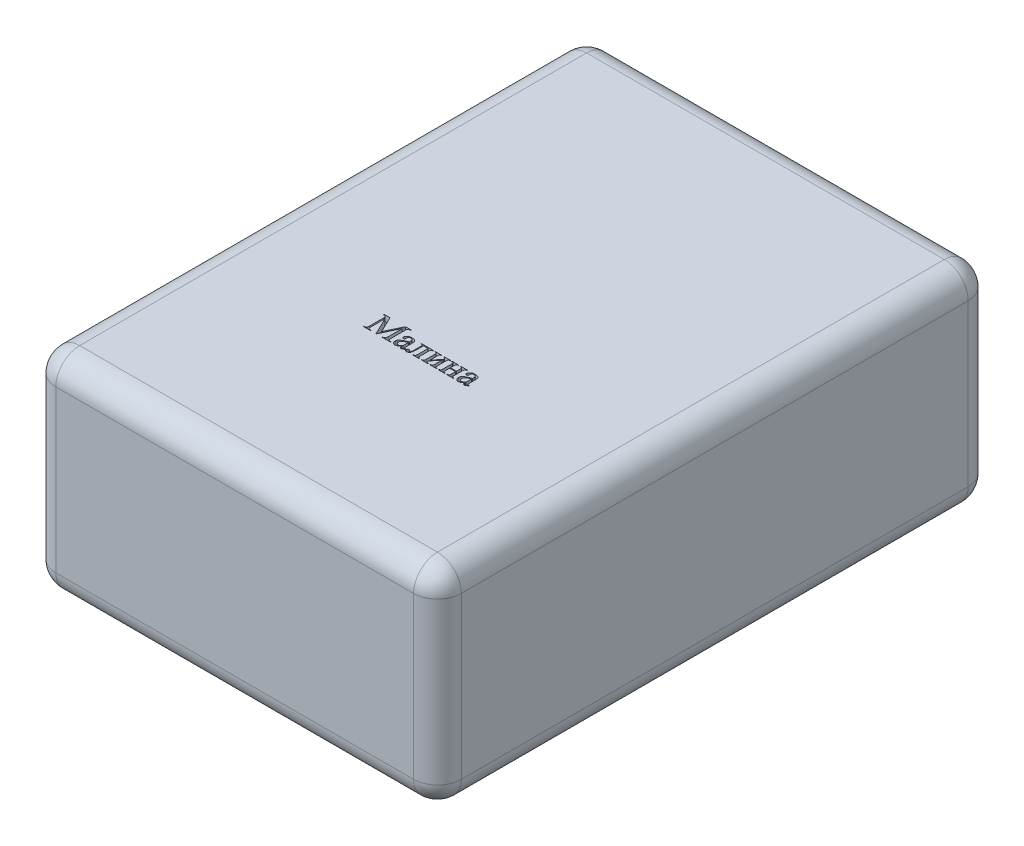
from build123d import *

# Parameters (mm, degrees)
SKETCH_1_W          = 68
SKETCH_1_H          = 93
EXTRUDE_1_DEPTH     = 35
SKETCH_2_R          = 1.5
CUT_EXTRUDE_1_DEPTH = 5
CUT_EXTRUDE_2_DEPTH = 1
FILLET_1_R          = 4


with BuildPart() as part:
    # Эскиз1 → Бобышка-Вытянуть1 (new body)
    with BuildSketch(Plane(origin=(0, 0, 0), x_dir=(1, 0, 0), z_dir=(0, 1, 0))):
        Rectangle(SKETCH_1_W, SKETCH_1_H)
    extrude(amount=EXTRUDE_1_DEPTH)

    # Эскиз2 → Вырез-Вытянуть1 (cut)
    with BuildSketch(Plane.XZ):
        with Locations(Location((20, 0, 0), (0, 0, 270))):
            Circle(SKETCH_2_R)
        with Locations(Location((-20, 0, 0), (0, 0, 270))):
            Circle(SKETCH_2_R)
    extrude(amount=-CUT_EXTRUDE_1_DEPTH, mode=Mode.SUBTRACT)

    # Эскиз3 → Вырез-Вытянуть2 (cut)
    # profile 1 of 6: a face of its own
    with BuildSketch(Plane(origin=(0, 35, 0), x_dir=(1, 0, 0), z_dir=(0, 1, 0))):
        with BuildLine():
            Line((-6.876278242, -15.938909671), (-8.286000464, -12.994139706))
            Line((-8.286000464, -12.994139706), (-8.286000464, -15.306965227))
            add(Edge.make_bspline(
                [(-8.286000464, -15.306965227), (-8.286036387, -15.333811298), (-8.286104549, -15.384749757), (-8.281755016, -15.457154027), (-8.277037345, -15.521848158), (-8.269202477, -15.578542427), (-8.260888196, -15.627848302), (-8.248500347, -15.668563983), (-8.235625296, -15.702397991), (-8.223275685, -15.72033213), (-8.217641089, -15.728514706)],
                knots=[0, 0, 0, 0, 1.48973486, 2.826663046, 4.025252461, 5.088590954, 6.003687083, 6.795186099, 7.45029523, 8, 8, 8, 8], degree=3))
            add(Edge.make_bspline(
                [(-8.217641089, -15.728514706), (-8.200462589, -15.74599363), (-8.165480149, -15.781587856), (-8.095240268, -15.817376133), (-8.012557284, -15.838563876), (-7.952957678, -15.840606485), (-7.921417131, -15.841687449)],
                knots=[0, 0, 0, 0, 0.893460505, 1.819450328, 2.846037184, 4, 4, 4, 4], degree=3))
            Line((-7.921417131, -15.841687449), (-7.799889353, -15.841687449))
            Line((-7.799889353, -15.841687449), (-7.799889353, -15.938909671))
            Line((-7.799889353, -15.938909671), (-9.015167131, -15.938909671))
            Line((-9.015167131, -15.938909671), (-9.015167131, -15.841687449))
            Line((-9.015167131, -15.841687449), (-8.893639353, -15.841687449))
            add(Edge.make_bspline(
                [(-8.893639353, -15.841687449), (-8.876140053, -15.841305447), (-8.842265284, -15.840565977), (-8.793511394, -15.833321815), (-8.748469314, -15.823266262), (-8.707484134, -15.807619561), (-8.67016689, -15.788182546), (-8.637031928, -15.763633985), (-8.60866068, -15.734176649), (-8.592613743, -15.712252285), (-8.584503068, -15.701170956)],
                knots=[0, 0, 0, 0, 1.182386838, 2.288838982, 3.326958154, 4.296765023, 5.246416275, 6.164047556, 7.072046332, 8, 8, 8, 8], degree=3))
            add(Edge.make_bspline(
                [(-8.584503068, -15.701170956), (-8.579975705, -15.692920025), (-8.570009103, -15.67475631), (-8.558979447, -15.642463413), (-8.550378289, -15.603133861), (-8.541854542, -15.557355686), (-8.535884286, -15.504317994), (-8.532777005, -15.444715815), (-8.529112251, -15.378150572), (-8.529075425, -15.331530474), (-8.52905602, -15.306965227)],
                knots=[0, 0, 0, 0, 0.561580455, 1.236271222, 2.028879402, 2.966584022, 4.017422664, 5.2149421, 6.532486222, 8, 8, 8, 8], degree=3))
            Line((-8.52905602, -15.306965227), (-8.52905602, -13.070854115))
            add(Edge.make_bspline(
                [(-8.52905602, -13.070854115), (-8.529438437, -13.033090794), (-8.530148393, -12.962983405), (-8.540146678, -12.866554344), (-8.554313006, -12.786205245), (-8.571984921, -12.740522051), (-8.579945777, -12.719942657)],
                knots=[0, 0, 0, 0, 1.269100049, 2.356076937, 3.259444487, 4, 4, 4, 4], degree=3))
            add(Edge.make_bspline(
                [(-8.579945777, -12.719942657), (-8.586616445, -12.707274014), (-8.600339558, -12.681211675), (-8.629494734, -12.64640325), (-8.666626678, -12.6155346), (-8.711210957, -12.586779556), (-8.767584425, -12.562621261), (-8.837719825, -12.54695684), (-8.921723829, -12.537331635), (-8.982474471, -12.536551642), (-9.015167131, -12.536131893)],
                knots=[0, 0, 0, 0, 0.685675889, 1.410594349, 2.160436148, 2.996293973, 3.94870651, 5.086176952, 6.431940446, 8, 8, 8, 8], degree=3))
            Line((-9.015167131, -12.536131893), (-9.015167131, -12.438909671))
            Line((-9.015167131, -12.438909671), (-8.018639353, -12.438909671))
            Line((-8.018639353, -12.438909671), (-6.716773034, -15.158093699))
            Line((-6.716773034, -15.158093699), (-5.414906714, -12.438909671))
            Line((-5.414906714, -12.438909671), (-4.445722686, -12.438909671))
            Line((-4.445722686, -12.438909671), (-4.445722686, -12.536131893))
            Line((-4.445722686, -12.536131893), (-4.564971818, -12.536131893))
            add(Edge.make_bspline(
                [(-4.564971818, -12.536131893), (-4.582726783, -12.53649584), (-4.616859546, -12.537195503), (-4.666085587, -12.544607664), (-4.711444006, -12.55441438), (-4.752632286, -12.570222761), (-4.790004254, -12.589593963), (-4.823097085, -12.614435718), (-4.852251313, -12.643372684), (-4.868318621, -12.665524799), (-4.876386749, -12.676648386)],
                knots=[0, 0, 0, 0, 1.192663738, 2.292818382, 3.341598875, 4.305885976, 5.250132179, 6.162540657, 7.077327887, 8, 8, 8, 8], degree=3))
            add(Edge.make_bspline(
                [(-4.876386749, -12.676648386), (-4.880914112, -12.684899317), (-4.890880714, -12.703063032), (-4.90191037, -12.735355929), (-4.910511528, -12.774685482), (-4.919035275, -12.820463656), (-4.925005531, -12.873501348), (-4.928112812, -12.933103527), (-4.931777566, -12.99966877), (-4.931814392, -13.046288868), (-4.931833797, -13.070854115)],
                knots=[0, 0, 0, 0, 0.561580455, 1.236271222, 2.028879402, 2.966584022, 4.017422664, 5.2149421, 6.532486222, 8, 8, 8, 8], degree=3))
            Line((-4.931833797, -13.070854115), (-4.931833797, -15.306965227))
            add(Edge.make_bspline(
                [(-4.931833797, -15.306965227), (-4.931866137, -15.333810551), (-4.931927498, -15.384747593), (-4.927623405, -15.457161334), (-4.922759422, -15.521824968), (-4.915373164, -15.578662197), (-4.905673358, -15.627729179), (-4.893816332, -15.668752675), (-4.879921955, -15.702473471), (-4.867074696, -15.720339288), (-4.861195777, -15.728514706)],
                knots=[0, 0, 0, 0, 1.486776415, 2.821049613, 4.017258766, 5.078485589, 5.994452933, 6.784380121, 7.443731031, 8, 8, 8, 8], degree=3))
            add(Edge.make_bspline(
                [(-4.861195777, -15.728514706), (-4.844032017, -15.74602478), (-4.80892212, -15.781843093), (-4.738390432, -15.817022432), (-4.655910826, -15.838704874), (-4.596527706, -15.840652494), (-4.564971818, -15.841687449)],
                knots=[0, 0, 0, 0, 0.893634595, 1.828003868, 2.845812335, 4, 4, 4, 4], degree=3))
            Line((-4.564971818, -15.841687449), (-4.445722686, -15.841687449))
            Line((-4.445722686, -15.841687449), (-4.445722686, -15.938909671))
            Line((-4.445722686, -15.938909671), (-5.90405602, -15.938909671))
            Line((-5.90405602, -15.938909671), (-5.90405602, -15.841687449))
            Line((-5.90405602, -15.841687449), (-5.782528242, -15.841687449))
            add(Edge.make_bspline(
                [(-5.782528242, -15.841687449), (-5.764776666, -15.841312345), (-5.730650417, -15.840591233), (-5.681623435, -15.833364114), (-5.636425797, -15.823069561), (-5.595178686, -15.808014804), (-5.558168466, -15.787933648), (-5.525180506, -15.763639231), (-5.496768943, -15.734378557), (-5.481211647, -15.712279024), (-5.473391957, -15.701170956)],
                knots=[0, 0, 0, 0, 1.198333024, 2.303717216, 3.340834392, 4.325725627, 5.259386468, 6.176132048, 7.08325442, 8, 8, 8, 8], degree=3))
            add(Edge.make_bspline(
                [(-5.473391957, -15.701170956), (-5.468864594, -15.692920025), (-5.458897991, -15.67475631), (-5.447868336, -15.642463413), (-5.439267178, -15.603133861), (-5.430743431, -15.557355686), (-5.424773175, -15.504317994), (-5.421665894, -15.444715815), (-5.41800114, -15.378150572), (-5.417964314, -15.331530474), (-5.417944909, -15.306965227)],
                knots=[0, 0, 0, 0, 0.561580455, 1.236271222, 2.028879402, 2.966584022, 4.017422664, 5.2149421, 6.532486222, 8, 8, 8, 8], degree=3))
            Line((-5.417944909, -15.306965227), (-5.417944909, -12.994139706))
            Line((-5.417944909, -12.994139706), (-6.827667131, -15.938909671))
            Line((-6.827667131, -15.938909671), (-6.876278242, -15.938909671))
        make_face()
    # profile 2 of 6: a face of its own
    with BuildSketch(Plane(origin=(0, 35, 0), x_dir=(1, 0, 0), z_dir=(0, 1, 0))):
        with BuildLine():
            add(Edge.make_bspline(
                [(-2.890167131, -15.600910539), (-2.918960068, -15.623030395), (-2.973573413, -15.664986496), (-3.052065141, -15.723042978), (-3.120997942, -15.775384656), (-3.182380519, -15.818945906), (-3.23507933, -15.855998916), (-3.279501721, -15.885195042), (-3.315064339, -15.907990036), (-3.33671114, -15.919032968), (-3.345896297, -15.923718699)],
                knots=[0, 0, 0, 0, 1.558875, 2.95681467, 4.191698034, 5.274657479, 6.188356203, 6.95716577, 7.557505181, 8, 8, 8, 8], degree=3))
            add(Edge.make_bspline(
                [(-3.345896297, -15.923718699), (-3.369230894, -15.933691571), (-3.41575288, -15.953574401), (-3.489200108, -15.97254508), (-3.564424312, -15.985689793), (-3.61547657, -15.986904772), (-3.641360707, -15.987520782)],
                knots=[0, 0, 0, 0, 0.998482016, 1.990665029, 2.981241918, 4, 4, 4, 4], degree=3))
            add(Edge.make_bspline(
                [(-3.641360707, -15.987520782), (-3.661381765, -15.986825375), (-3.700553833, -15.985464782), (-3.75817724, -15.978059967), (-3.812902241, -15.964316029), (-3.864661679, -15.945102969), (-3.914149751, -15.921569906), (-3.960447789, -15.891506928), (-4.004672683, -15.856637101), (-4.045538805, -15.816299558), (-4.082632492, -15.771895503), (-4.114506393, -15.723532487), (-4.142622882, -15.67229414), (-4.163839569, -15.616858263), (-4.182004199, -15.558651736), (-4.193544343, -15.496952901), (-4.201692464, -15.432002541), (-4.202336784, -15.387505093), (-4.202667131, -15.364690921)],
                knots=[0, 0, 0, 0, 1.021269733, 1.99815853, 2.956354521, 3.891750869, 4.809880197, 5.744652621, 6.700410006, 7.677298803, 8.667491899, 9.645063, 10.627057522, 11.641202316, 12.666381854, 13.732374063, 14.837371315, 16, 16, 16, 16], degree=3))
            add(Edge.make_bspline(
                [(-4.202667131, -15.364690921), (-4.202033224, -15.335984472), (-4.200800542, -15.280162513), (-4.184308544, -15.200113344), (-4.162133122, -15.124829772), (-4.13742052, -15.080009527), (-4.125193172, -15.057833282)],
                knots=[0, 0, 0, 0, 1.073591545, 2.087683635, 3.053820535, 4, 4, 4, 4], degree=3))
            add(Edge.make_bspline(
                [(-4.125193172, -15.057833282), (-4.105312109, -15.02777403), (-4.063555069, -14.96463931), (-3.979375108, -14.879513242), (-3.877367805, -14.796335018), (-3.777618271, -14.730826225), (-3.685722968, -14.677126769), (-3.603606674, -14.635314715), (-3.51115249, -14.590316295), (-3.408486191, -14.54229105), (-3.293733568, -14.494155659), (-3.168958758, -14.442650575), (-3.03350905, -14.388271035), (-2.939110545, -14.353019895), (-2.890167131, -14.334743004)],
                knots=[0, 0, 0, 0, 0.890335071, 1.870008429, 2.947759746, 4.145438777, 4.819447813, 5.581919563, 6.425634938, 7.365025325, 8.387143385, 9.505655779, 10.706740942, 12, 12, 12, 12], degree=3))
            Line((-2.890167131, -14.334743004), (-2.890167131, -14.245875817))
            add(Edge.make_bspline(
                [(-2.890167131, -14.245875817), (-2.89039643, -14.218779255), (-2.890838378, -14.166553839), (-2.895921798, -14.09143546), (-2.90550665, -14.023127808), (-2.915879369, -13.961070436), (-2.93219926, -13.906336605), (-2.950941386, -13.857739725), (-2.973603889, -13.815806915), (-3.008062016, -13.769003317), (-3.060934676, -13.72189797), (-3.13693247, -13.681517919), (-3.225750903, -13.657725153), (-3.289031126, -13.655407678), (-3.32235029, -13.654187449)],
                knots=[0, 0, 0, 0, 1.156239016, 2.228513829, 3.209486664, 4.099496727, 4.909803097, 5.642093741, 6.318967722, 6.93697649, 8.115067704, 9.304155298, 10.580547167, 12, 12, 12, 12], degree=3))
            add(Edge.make_bspline(
                [(-3.32235029, -13.654187449), (-3.347794101, -13.655001594), (-3.396507547, -13.656560317), (-3.465251644, -13.674126233), (-3.526851878, -13.700560074), (-3.560360774, -13.728049957), (-3.576799075, -13.741535539)],
                knots=[0, 0, 0, 0, 1.106638015, 2.118713769, 3.077106298, 4, 4, 4, 4], degree=3))
            add(Edge.make_bspline(
                [(-3.576799075, -13.741535539), (-3.591696079, -13.755878072), (-3.620162292, -13.783284765), (-3.650308297, -13.832951489), (-3.669871717, -13.885426979), (-3.672130009, -13.922139066), (-3.673261749, -13.940537275)],
                knots=[0, 0, 0, 0, 1.084622452, 2.072570699, 3.034071598, 4, 4, 4, 4], degree=3))
            Line((-3.673261749, -13.940537275), (-3.667944909, -14.089408803))
            add(Edge.make_bspline(
                [(-3.667944909, -14.089408803), (-3.668570193, -14.10796472), (-3.669757213, -14.143190629), (-3.681452266, -14.192822322), (-3.70000239, -14.236210075), (-3.727499156, -14.271713973), (-3.760150891, -14.300266979), (-3.79869358, -14.320373252), (-3.841855434, -14.332973246), (-3.872426072, -14.334140293), (-3.888214006, -14.334743004)],
                knots=[0, 0, 0, 0, 1.192988088, 2.264727143, 3.264608775, 4.207008523, 5.131898225, 6.036298471, 6.985863792, 8, 8, 8, 8], degree=3))
            add(Edge.make_bspline(
                [(-3.888214006, -14.334743004), (-3.903535631, -14.334247787), (-3.933263966, -14.333286924), (-3.974932117, -14.31903231), (-4.013512706, -14.29964841), (-4.04590167, -14.270084623), (-4.073207883, -14.234062616), (-4.091828351, -14.190778912), (-4.103594335, -14.141933006), (-4.104808945, -14.107459134), (-4.105444909, -14.089408803)],
                knots=[0, 0, 0, 0, 0.992015986, 1.924794819, 2.838757396, 3.784255213, 4.749783075, 5.760236574, 6.827272098, 8, 8, 8, 8], degree=3))
            add(Edge.make_bspline(
                [(-4.105444909, -14.089408803), (-4.104682316, -14.071375978), (-4.103165381, -14.035505381), (-4.091875338, -13.982464608), (-4.074655595, -13.93041398), (-4.048869245, -13.879989385), (-4.016701836, -13.830457297), (-3.977883678, -13.781521256), (-3.931114646, -13.734691372), (-3.878118426, -13.689033897), (-3.818530177, -13.646799426), (-3.75302308, -13.609373997), (-3.681416461, -13.57808092), (-3.604359165, -13.552519134), (-3.521225715, -13.532768754), (-3.432649527, -13.51844028), (-3.338203197, -13.510201812), (-3.273501917, -13.508980488), (-3.24031904, -13.508354115)],
                knots=[0, 0, 0, 0, 0.751350949, 1.494574915, 2.252349993, 3.031299287, 3.848234099, 4.712108084, 5.630260355, 6.603499815, 7.625714709, 8.670571574, 9.743474444, 10.878456939, 12.051105368, 13.302367809, 14.616484898, 16, 16, 16, 16], degree=3))
            add(Edge.make_bspline(
                [(-3.24031904, -13.508354115), (-3.19011076, -13.509606125), (-3.093832453, -13.512006951), (-2.956756273, -13.531725696), (-2.832930922, -13.563825106), (-2.759353966, -13.598639636), (-2.723825985, -13.61545047)],
                knots=[0, 0, 0, 0, 1.131049808, 2.168876517, 3.115808485, 4, 4, 4, 4], degree=3))
            add(Edge.make_bspline(
                [(-2.723825985, -13.61545047), (-2.699407253, -13.630036748), (-2.650784644, -13.659080965), (-2.588489292, -13.7183486), (-2.536884146, -13.789121368), (-2.511812711, -13.84257898), (-2.498999596, -13.869899254)],
                knots=[0, 0, 0, 0, 0.983173165, 1.957695623, 2.956251224, 4, 4, 4, 4], degree=3))
            add(Edge.make_bspline(
                [(-2.498999596, -13.869899254), (-2.495320445, -13.880488799), (-2.487267488, -13.903667281), (-2.477183629, -13.942912889), (-2.470566055, -13.989830063), (-2.463118208, -14.043661452), (-2.459306824, -14.105085491), (-2.455229571, -14.173672552), (-2.45307543, -14.249913981), (-2.452807466, -14.303094315), (-2.452667131, -14.330945261)],
                knots=[0, 0, 0, 0, 0.578071798, 1.265288381, 2.085304142, 3.019791722, 4.067310373, 5.257317904, 6.563636446, 8, 8, 8, 8], degree=3))
            Line((-2.452667131, -14.330945261), (-2.452667131, -15.145940921))
            add(Edge.make_bspline(
                [(-2.452667131, -15.145940921), (-2.452755509, -15.173285288), (-2.452922451, -15.224937076), (-2.451814913, -15.298355173), (-2.451498733, -15.363184205), (-2.449593699, -15.419882375), (-2.4485475, -15.468273498), (-2.445957946, -15.508506028), (-2.444122628, -15.540473786), (-2.440318331, -15.570762805), (-2.433708621, -15.599972114), (-2.425148672, -15.629331711), (-2.413767238, -15.652421578), (-2.397227954, -15.674922021), (-2.369203282, -15.691343764), (-2.345249776, -15.694362847), (-2.333417999, -15.695854115)],
                knots=[0, 0, 0, 0, 1.895498962, 3.580478337, 5.089959178, 6.389201248, 7.513008224, 8.444695769, 9.183712318, 9.732301295, 10.558500312, 11.257899372, 11.846575001, 12.334540979, 13.177350527, 14, 14, 14, 14], degree=3))
            add(Edge.make_bspline(
                [(-2.333417999, -15.695854115), (-2.320821989, -15.695101953), (-2.296758158, -15.693664996), (-2.274775226, -15.683830675), (-2.264299075, -15.679144046)],
                knots=[0, 0, 0, 0, 1.04688317, 2, 2, 2, 2], degree=3))
            add(Edge.make_bspline(
                [(-2.264299075, -15.679144046), (-2.253513516, -15.671742733), (-2.22672602, -15.653360503), (-2.184077783, -15.614272211), (-2.126927343, -15.563685289), (-2.086351835, -15.523671024), (-2.063778242, -15.501409671)],
                knots=[0, 0, 0, 0, 0.584543641, 1.451798638, 2.582345273, 4, 4, 4, 4], degree=3))
            Line((-2.063778242, -15.501409671), (-2.063778242, -15.637368872))
            add(Edge.make_bspline(
                [(-2.063778242, -15.637368872), (-2.087228508, -15.665022805), (-2.132336043, -15.718216262), (-2.202883066, -15.789872074), (-2.273047459, -15.85027514), (-2.34202645, -15.900335704), (-2.410756998, -15.938592926), (-2.478397096, -15.966607145), (-2.545675967, -15.984473125), (-2.590802885, -15.986518021), (-2.612931888, -15.987520782)],
                knots=[0, 0, 0, 0, 1.29495671, 2.490901519, 3.587659578, 4.59909354, 5.530268421, 6.390197302, 7.210596943, 8, 8, 8, 8], degree=3))
            add(Edge.make_bspline(
                [(-2.612931888, -15.987520782), (-2.633073299, -15.986682917), (-2.671849183, -15.985069873), (-2.726545382, -15.967431155), (-2.77467439, -15.939699718), (-2.81664919, -15.900319911), (-2.850103438, -15.846441629), (-2.87222249, -15.777457014), (-2.887783997, -15.694255048), (-2.889331, -15.633660781), (-2.890167131, -15.600910539)],
                knots=[0, 0, 0, 0, 0.892412594, 1.718056717, 2.524775051, 3.344648327, 4.249949684, 5.310413251, 6.546320934, 8, 8, 8, 8], degree=3))
        make_face()
        with BuildLine():
            Line((-2.890167131, -15.42545481), (-2.890167131, -14.480576338))
            add(Edge.make_bspline(
                [(-2.890167131, -14.480576338), (-2.921044854, -14.493766029), (-2.979773634, -14.518852544), (-3.063890753, -14.554338601), (-3.138893711, -14.587954777), (-3.205622981, -14.618034607), (-3.263548533, -14.645513587), (-3.312944557, -14.669777728), (-3.35409068, -14.690837411), (-3.37834127, -14.704574036), (-3.389190568, -14.710719567)],
                knots=[0, 0, 0, 0, 1.465697383, 2.787725602, 3.985057731, 5.053380534, 5.982790254, 6.783498627, 7.455758124, 8, 8, 8, 8], degree=3))
            add(Edge.make_bspline(
                [(-3.389190568, -14.710719567), (-3.421015437, -14.730085993), (-3.48137389, -14.766815995), (-3.560971101, -14.829078833), (-3.627295945, -14.891757235), (-3.678977712, -14.957134517), (-3.718364796, -15.024571457), (-3.744362429, -15.095157629), (-3.762547385, -15.168321172), (-3.764285881, -15.218491273), (-3.765167131, -15.243922692)],
                knots=[0, 0, 0, 0, 1.302370349, 2.470051283, 3.52876103, 4.487475757, 5.376328791, 6.248248042, 7.112030167, 8, 8, 8, 8], degree=3))
            add(Edge.make_bspline(
                [(-3.765167131, -15.243922692), (-3.763978595, -15.275189482), (-3.761689147, -15.335417966), (-3.74047126, -15.421962245), (-3.705483816, -15.500014596), (-3.65758574, -15.568148592), (-3.601356293, -15.624263879), (-3.539111477, -15.665798684), (-3.471746713, -15.690738699), (-3.42533827, -15.694147451), (-3.402102895, -15.695854115)],
                knots=[0, 0, 0, 0, 1.168223595, 2.250321665, 3.310218344, 4.350849945, 5.348877238, 6.265796639, 7.13173418, 8, 8, 8, 8], degree=3))
            add(Edge.make_bspline(
                [(-3.402102895, -15.695854115), (-3.385081489, -15.694792391), (-3.349643836, -15.692581938), (-3.294672628, -15.679651405), (-3.23635516, -15.657888704), (-3.174064275, -15.628168638), (-3.108504308, -15.589363174), (-3.0384727, -15.543137923), (-2.965237269, -15.487395721), (-2.915848157, -15.446644409), (-2.890167131, -15.42545481)],
                knots=[0, 0, 0, 0, 0.693887409, 1.444636304, 2.289794561, 3.226439617, 4.252586567, 5.391242417, 6.643515343, 8, 8, 8, 8], degree=3))
        make_face(mode=Mode.SUBTRACT)
    # profile 3 of 6: a face of its own
    with BuildSketch(Plane(origin=(0, 35, 0), x_dir=(1, 0, 0), z_dir=(0, 1, 0))):
        with BuildLine():
            Line((-1.626278242, -13.556965227), (0.415388425, -13.556965227))
            Line((0.415388425, -13.556965227), (0.415388425, -13.654187449))
            add(Edge.make_bspline(
                [(0.415388425, -13.654187449), (0.390058985, -13.654621939), (0.343870177, -13.655414243), (0.281245874, -13.660898219), (0.232039298, -13.670744532), (0.185483291, -13.689169761), (0.144588075, -13.723462308), (0.11285693, -13.757624434), (0.097948313, -13.787934639), (0.092933875, -13.811343329), (0.086053656, -13.840721848), (0.083471861, -13.877770656), (0.078991976, -13.921206891), (0.077258907, -13.971926648), (0.07562102, -14.029392677), (0.07528698, -14.070164674), (0.075110647, -14.091687449)],
                knots=[0, 0, 0, 0, 1.584210393, 2.888843606, 3.926246297, 4.714344826, 5.990707065, 7.227458523, 7.595770758, 8.087420743, 8.717843885, 9.482035482, 10.403870704, 11.450058471, 12.653933574, 14, 14, 14, 14], degree=3))
            Line((0.075110647, -14.091687449), (0.075110647, -15.404187449))
            add(Edge.make_bspline(
                [(0.075110647, -15.404187449), (0.075402363, -15.424694163), (0.075956988, -15.463682562), (0.076150645, -15.518907218), (0.078663545, -15.567774791), (0.081536849, -15.610079381), (0.085169205, -15.645833628), (0.089718167, -15.674991176), (0.094520213, -15.697759127), (0.106199213, -15.728854044), (0.137019477, -15.765146755), (0.177612495, -15.801365257), (0.225178956, -15.823661499), (0.27656214, -15.832939995), (0.341193734, -15.841181285), (0.389013317, -15.841507515), (0.415388425, -15.841687449)],
                knots=[0, 0, 0, 0, 1.282707916, 2.438748994, 3.453282145, 4.342284203, 5.090714305, 5.699887127, 6.187688219, 6.543528699, 7.765983447, 9.10408532, 9.925812853, 11.013000354, 12.352506862, 14, 14, 14, 14], degree=3))
            Line((0.415388425, -15.841687449), (0.415388425, -15.938909671))
            Line((0.415388425, -15.938909671), (-0.702667131, -15.938909671))
            Line((-0.702667131, -15.938909671), (-0.702667131, -15.841687449))
            add(Edge.make_bspline(
                [(-0.702667131, -15.841687449), (-0.678862587, -15.84139477), (-0.635269274, -15.840858786), (-0.57592193, -15.837197732), (-0.528585276, -15.83173475), (-0.490930719, -15.823037458), (-0.460868652, -15.807522401), (-0.435023789, -15.785751512), (-0.413947183, -15.755507312), (-0.398170809, -15.725593115), (-0.387118068, -15.695824538), (-0.380568765, -15.66671706), (-0.375884335, -15.631825174), (-0.370032098, -15.591424001), (-0.366558698, -15.545258756), (-0.364480784, -15.493323846), (-0.36292865, -15.435590385), (-0.362574997, -15.395073885), (-0.362389353, -15.373805504)],
                knots=[0, 0, 0, 0, 1.619790397, 2.966325718, 4.043311488, 4.862317155, 5.578882398, 6.324474976, 7.137661701, 8.070040465, 8.620525552, 9.293297089, 10.094904341, 11.015913183, 12.070340319, 13.242977978, 14.552752706, 16, 16, 16, 16], degree=3))
            Line((-0.362389353, -15.373805504), (-0.362389353, -13.70279856))
            Line((-0.362389353, -13.70279856), (-1.140167131, -13.70279856))
            Line((-1.140167131, -13.70279856), (-1.140167131, -14.71983415))
            add(Edge.make_bspline(
                [(-1.140167131, -14.71983415), (-1.140303084, -14.766167497), (-1.140564608, -14.855295665), (-1.14281157, -14.983420632), (-1.14659192, -15.10090953), (-1.151629145, -15.207538627), (-1.158786411, -15.303467541), (-1.165692412, -15.388683979), (-1.175631565, -15.463163969), (-1.190198174, -15.546299905), (-1.213596942, -15.637164674), (-1.255866532, -15.732277627), (-1.309111582, -15.812965817), (-1.374521401, -15.87749141), (-1.448377759, -15.926253735), (-1.527630157, -15.961663124), (-1.612407454, -15.983996246), (-1.670954043, -15.986332987), (-1.700714006, -15.987520782)],
                knots=[0, 0, 0, 0, 1.42271662, 2.736778907, 3.934650691, 5.032175841, 6.014232294, 6.888416739, 7.656971435, 8.320342229, 9.480171711, 10.527654744, 11.502266939, 12.431319192, 13.328298626, 14.205278702, 15.087720741, 16, 16, 16, 16], degree=3))
            add(Edge.make_bspline(
                [(-1.700714006, -15.987520782), (-1.725359275, -15.986843301), (-1.771844248, -15.985565461), (-1.836661662, -15.970968837), (-1.892048838, -15.947615239), (-1.937765563, -15.913941118), (-1.973634365, -15.870512855), (-1.997805347, -15.816734153), (-2.013395921, -15.754457776), (-2.01455537, -15.709631645), (-2.015167131, -15.685979984)],
                knots=[0, 0, 0, 0, 1.182968001, 2.231269376, 3.174287439, 4.053139709, 4.93527333, 5.850059015, 6.865624267, 8, 8, 8, 8], degree=3))
            add(Edge.make_bspline(
                [(-2.015167131, -15.685979984), (-2.014663566, -15.669729758), (-2.013685568, -15.638169389), (-2.003890388, -15.59306569), (-1.986772671, -15.552868243), (-1.964123891, -15.517417467), (-1.935491888, -15.488826638), (-1.90260882, -15.467201439), (-1.865142896, -15.454663419), (-1.838790863, -15.453430623), (-1.825279978, -15.45279856)],
                knots=[0, 0, 0, 0, 1.156908126, 2.246888681, 3.265553893, 4.256358431, 5.225909998, 6.126720535, 7.039555572, 8, 8, 8, 8], degree=3))
            add(Edge.make_bspline(
                [(-1.825279978, -15.45279856), (-1.810437226, -15.453813264), (-1.780399299, -15.455866767), (-1.737140673, -15.473360527), (-1.694825917, -15.499455857), (-1.670846139, -15.52409389), (-1.658179284, -15.537108456)],
                knots=[0, 0, 0, 0, 0.921863424, 1.865615479, 2.872552538, 4, 4, 4, 4], degree=3))
            add(Edge.make_bspline(
                [(-1.658179284, -15.537108456), (-1.642751739, -15.553380015), (-1.614943125, -15.582709993), (-1.574479094, -15.617540551), (-1.539929883, -15.641561238), (-1.516868333, -15.64554383), (-1.50702911, -15.647243004)],
                knots=[0, 0, 0, 0, 1.409424025, 2.540529421, 3.377316038, 4, 4, 4, 4], degree=3))
            add(Edge.make_bspline(
                [(-1.50702911, -15.647243004), (-1.497580225, -15.64669058), (-1.478976995, -15.645602951), (-1.452425373, -15.635919723), (-1.427991268, -15.620128421), (-1.40642611, -15.597468689), (-1.385414237, -15.570156731), (-1.368206324, -15.535625999), (-1.352701131, -15.495592622), (-1.337621917, -15.449106658), (-1.326260521, -15.39450718), (-1.314393981, -15.331578918), (-1.305948087, -15.259223008), (-1.298023491, -15.177967504), (-1.293435518, -15.087220719), (-1.288358551, -14.987499014), (-1.286476256, -14.878333191), (-1.286163583, -14.802624723), (-1.286000464, -14.763128421)],
                knots=[0, 0, 0, 0, 0.466473316, 0.918405838, 1.380819845, 1.89488115, 2.458927032, 3.081242191, 3.79581025, 4.58467825, 5.496934622, 6.554138747, 7.7543644, 9.101384603, 10.595550974, 12.251793908, 14.04460077, 16, 16, 16, 16], degree=3))
            Line((-1.286000464, -14.763128421), (-1.286000464, -14.237520782))
            add(Edge.make_bspline(
                [(-1.286000464, -14.237520782), (-1.286027438, -14.206374739), (-1.286078768, -14.147103978), (-1.289639438, -14.063056362), (-1.292907831, -13.988302051), (-1.298505341, -13.92332637), (-1.307403502, -13.86824602), (-1.315518065, -13.822452866), (-1.326980872, -13.786351364), (-1.339788736, -13.757678168), (-1.358073819, -13.735845879), (-1.380535984, -13.717430837), (-1.408523753, -13.701770215), (-1.441296661, -13.686845479), (-1.480198232, -13.676443384), (-1.523896077, -13.666092039), (-1.573194083, -13.65877728), (-1.608030698, -13.655765191), (-1.626278242, -13.654187449)],
                knots=[0, 0, 0, 0, 1.871261919, 3.56100197, 5.053816003, 6.367783219, 7.475829268, 8.406686411, 9.157229107, 9.749169604, 10.279010549, 10.851674757, 11.485712374, 12.200885609, 13.009611215, 13.899019447, 14.899498895, 16, 16, 16, 16], degree=3))
            Line((-1.626278242, -13.654187449), (-1.626278242, -13.556965227))
        make_face()
    # profile 4 of 6: a face of its own
    with BuildSketch(Plane(origin=(0, 35, 0), x_dir=(1, 0, 0), z_dir=(0, 1, 0))):
        with BuildLine():
            Line((1.484832869, -15.258354115), (2.505666203, -13.994465227))
            add(Edge.make_bspline(
                [(2.505666203, -13.994465227), (2.504181089, -13.965269842), (2.501418203, -13.910955098), (2.486120988, -13.836582958), (2.461369398, -13.776215226), (2.426509396, -13.729016473), (2.379143818, -13.694509373), (2.31909807, -13.672163455), (2.246672533, -13.656613182), (2.193845247, -13.655036676), (2.165388425, -13.654187449)],
                knots=[0, 0, 0, 0, 1.25603524, 2.336712915, 3.248901739, 4.041614774, 4.827794657, 5.731626579, 6.778080301, 8, 8, 8, 8], degree=3))
            Line((2.165388425, -13.654187449), (2.165388425, -13.556965227))
            Line((2.165388425, -13.556965227), (3.28344398, -13.556965227))
            Line((3.28344398, -13.556965227), (3.28344398, -13.654187449))
            add(Edge.make_bspline(
                [(3.28344398, -13.654187449), (3.258364971, -13.654612726), (3.212676396, -13.65538749), (3.150588097, -13.6609802), (3.101576043, -13.670691044), (3.054810719, -13.689500436), (3.012721936, -13.722896016), (2.98092597, -13.757642385), (2.966001353, -13.78793129), (2.960990416, -13.811344641), (2.954108853, -13.840721372), (2.951527543, -13.877770825), (2.94704749, -13.921206835), (2.945314476, -13.971926666), (2.943676571, -14.029392671), (2.943342534, -14.070164672), (2.943166203, -14.091687449)],
                knots=[0, 0, 0, 0, 1.569088529, 2.858542623, 3.896412245, 4.684865494, 5.987102112, 7.224410228, 7.592888239, 8.084759514, 8.715466407, 9.480001963, 10.4022521, 11.448910752, 12.653327714, 14, 14, 14, 14], degree=3))
            Line((2.943166203, -14.091687449), (2.943166203, -15.404187449))
            add(Edge.make_bspline(
                [(2.943166203, -15.404187449), (2.943457918, -15.424694163), (2.944012543, -15.463682562), (2.944206201, -15.518907218), (2.9467191, -15.567774791), (2.949592405, -15.610079381), (2.95322476, -15.645833628), (2.957773723, -15.674991176), (2.962575768, -15.697759127), (2.974254769, -15.728854044), (3.005075032, -15.765146755), (3.045668051, -15.801365257), (3.093234511, -15.823661499), (3.144617696, -15.832939995), (3.209249289, -15.841181285), (3.257068873, -15.841507515), (3.28344398, -15.841687449)],
                knots=[0, 0, 0, 0, 1.282707916, 2.438748994, 3.453282145, 4.342284203, 5.090714305, 5.699887127, 6.187688219, 6.543528699, 7.765983447, 9.10408532, 9.925812853, 11.013000354, 12.352506862, 14, 14, 14, 14], degree=3))
            Line((3.28344398, -15.841687449), (3.28344398, -15.938909671))
            Line((3.28344398, -15.938909671), (2.165388425, -15.938909671))
            Line((2.165388425, -15.938909671), (2.165388425, -15.841687449))
            add(Edge.make_bspline(
                [(2.165388425, -15.841687449), (2.196606825, -15.84108898), (2.253878511, -15.839991061), (2.331272088, -15.825753206), (2.393049509, -15.804090305), (2.432876748, -15.775135576), (2.454919294, -15.744333017), (2.468158891, -15.714754396), (2.480163941, -15.679173299), (2.490130847, -15.63700397), (2.496307651, -15.588105627), (2.501560352, -15.532634083), (2.505707876, -15.470580535), (2.50568051, -15.426981425), (2.505666203, -15.404187449)],
                knots=[0, 0, 0, 0, 1.690346571, 3.101023719, 4.248137943, 5.217279308, 5.708751061, 6.285910337, 6.967405867, 7.743156262, 8.630285284, 9.636903878, 10.764553721, 12, 12, 12, 12], degree=3))
            Line((2.505666203, -15.404187449), (2.505666203, -14.237520782))
            Line((2.505666203, -14.237520782), (1.484832869, -15.501409671))
            add(Edge.make_bspline(
                [(1.484832869, -15.501409671), (1.48645977, -15.531089513), (1.489454456, -15.585722081), (1.502749971, -15.660424366), (1.522558301, -15.720506264), (1.550429313, -15.769679459), (1.596204287, -15.803469371), (1.657389391, -15.82525479), (1.735394558, -15.839052228), (1.793394702, -15.84075586), (1.825110647, -15.841687449)],
                knots=[0, 0, 0, 0, 1.25704126, 2.313873185, 3.198075723, 3.929341958, 4.662175754, 5.547415936, 6.658865039, 8, 8, 8, 8], degree=3))
            Line((1.825110647, -15.841687449), (1.825110647, -15.938909671))
            Line((1.825110647, -15.938909671), (0.707055091, -15.938909671))
            Line((0.707055091, -15.938909671), (0.707055091, -15.841687449))
            add(Edge.make_bspline(
                [(0.707055091, -15.841687449), (0.724531723, -15.841366016), (0.757756362, -15.840754943), (0.80494409, -15.837030739), (0.847068762, -15.830980662), (0.884593988, -15.822972857), (0.917259593, -15.811716368), (0.945033728, -15.79787677), (0.968584259, -15.782230059), (0.986619006, -15.762043917), (1.001912451, -15.738102313), (1.013242199, -15.70820037), (1.024105107, -15.67272981), (1.033002454, -15.63106792), (1.039714715, -15.583097786), (1.043900211, -15.528810517), (1.047170218, -15.468535354), (1.047277179, -15.426219663), (1.047332869, -15.404187449)],
                knots=[0, 0, 0, 0, 1.258720138, 2.392939594, 3.406399757, 4.322135718, 5.152563947, 5.886494953, 6.554242216, 7.173684194, 7.821207301, 8.589879974, 9.46666201, 10.493161759, 11.65360857, 12.952884252, 14.413479575, 16, 16, 16, 16], degree=3))
            Line((1.047332869, -15.404187449), (1.047332869, -14.121309845))
            add(Edge.make_bspline(
                [(1.047332869, -14.121309845), (1.047040465, -14.099030903), (1.046485557, -14.056751237), (1.046300175, -13.996969902), (1.043772894, -13.944309383), (1.04096599, -13.898952062), (1.037158879, -13.860964594), (1.0331258, -13.8301032), (1.026973527, -13.806592516), (1.015756698, -13.77431215), (0.98567114, -13.736129088), (0.945590262, -13.697834798), (0.898462665, -13.673790305), (0.847136345, -13.662257435), (0.781966684, -13.654920206), (0.733668803, -13.654447774), (0.707055091, -13.654187449)],
                knots=[0, 0, 0, 0, 1.341186991, 2.545225849, 3.597763913, 4.514180269, 5.279969602, 5.896380446, 6.384291384, 6.741045424, 7.945855608, 9.251949869, 10.056200149, 11.094855542, 12.399170382, 14, 14, 14, 14], degree=3))
            Line((0.707055091, -13.654187449), (0.707055091, -13.556965227))
            Line((0.707055091, -13.556965227), (1.825110647, -13.556965227))
            Line((1.825110647, -13.556965227), (1.825110647, -13.654187449))
            add(Edge.make_bspline(
                [(1.825110647, -13.654187449), (1.800031637, -13.654612726), (1.754343063, -13.65538749), (1.692254764, -13.6609802), (1.64324271, -13.670691044), (1.596477385, -13.689500436), (1.554388602, -13.722896016), (1.522592637, -13.757642385), (1.50766802, -13.78793129), (1.502657083, -13.811344641), (1.49577552, -13.840721372), (1.49319421, -13.877770825), (1.488714156, -13.921206835), (1.486981143, -13.971926666), (1.485343238, -14.029392671), (1.485009201, -14.070164672), (1.484832869, -14.091687449)],
                knots=[0, 0, 0, 0, 1.569088529, 2.858542623, 3.896412245, 4.684865494, 5.987102112, 7.224410228, 7.592888239, 8.084759514, 8.715466407, 9.480001963, 10.4022521, 11.448910752, 12.653327714, 14, 14, 14, 14], degree=3))
            Line((1.484832869, -14.091687449), (1.484832869, -15.258354115))
        make_face()
    # profile 5 of 6: a face of its own
    with BuildSketch(Plane(origin=(0, 35, 0), x_dir=(1, 0, 0), z_dir=(0, 1, 0))):
        with BuildLine():
            Line((4.304277314, -14.626409671), (5.325110647, -14.626409671))
            Line((5.325110647, -14.626409671), (5.325110647, -14.091687449))
            add(Edge.make_bspline(
                [(5.325110647, -14.091687449), (5.32517938, -14.059018865), (5.325304119, -13.999730242), (5.321199723, -13.920211314), (5.316743711, -13.859248936), (5.309370373, -13.813976023), (5.297506245, -13.778812536), (5.278399893, -13.749501583), (5.253594944, -13.722830204), (5.222631355, -13.697205046), (5.180557445, -13.677483708), (5.126670057, -13.663305293), (5.059976312, -13.655879619), (5.011179495, -13.654780754), (4.984832869, -13.654187449)],
                knots=[0, 0, 0, 0, 1.755383208, 3.185759555, 4.278495852, 5.039162179, 5.646019468, 6.257587626, 6.902890959, 7.599920358, 8.40320705, 9.377050097, 10.583803534, 12, 12, 12, 12], degree=3))
            Line((4.984832869, -13.654187449), (4.984832869, -13.556965227))
            Line((4.984832869, -13.556965227), (6.102888425, -13.556965227))
            Line((6.102888425, -13.556965227), (6.102888425, -13.654187449))
            add(Edge.make_bspline(
                [(6.102888425, -13.654187449), (6.079338436, -13.654677769), (6.035439938, -13.655591755), (5.97446896, -13.660764005), (5.923794004, -13.672217467), (5.882302008, -13.687082787), (5.849269911, -13.706961295), (5.821751703, -13.729707032), (5.801198751, -13.757880459), (5.784201171, -13.791940373), (5.77425769, -13.839347375), (5.767400324, -13.904378527), (5.76325833, -13.990878684), (5.762841645, -14.055733734), (5.762610647, -14.091687449)],
                knots=[0, 0, 0, 0, 1.263351912, 2.354958694, 3.273916767, 4.043047933, 4.706674289, 5.332559974, 5.943541481, 6.562913514, 7.359825143, 8.521860562, 10.071822691, 12, 12, 12, 12], degree=3))
            Line((5.762610647, -14.091687449), (5.762610647, -15.404187449))
            add(Edge.make_bspline(
                [(5.762610647, -15.404187449), (5.763038365, -15.436843434), (5.763814436, -15.496095957), (5.765913812, -15.576264085), (5.772138508, -15.638039304), (5.778721784, -15.684877238), (5.791905305, -15.720802826), (5.811150517, -15.751087388), (5.838177039, -15.77676571), (5.870240258, -15.80165457), (5.913567433, -15.819633008), (5.966708573, -15.832984884), (6.031326166, -15.839818863), (6.077812116, -15.841032673), (6.102888425, -15.841687449)],
                knots=[0, 0, 0, 0, 1.755540165, 3.185332866, 4.306421081, 5.093877349, 5.718179628, 6.348532491, 7.002811195, 7.713128056, 8.517220513, 9.50071166, 10.651787759, 12, 12, 12, 12], degree=3))
            Line((6.102888425, -15.841687449), (6.102888425, -15.938909671))
            Line((6.102888425, -15.938909671), (4.984832869, -15.938909671))
            Line((4.984832869, -15.938909671), (4.984832869, -15.841687449))
            add(Edge.make_bspline(
                [(4.984832869, -15.841687449), (5.016051269, -15.84108898), (5.073322955, -15.839991061), (5.150716533, -15.825753206), (5.212493953, -15.804090305), (5.252321193, -15.775135576), (5.274363738, -15.744333017), (5.287603336, -15.714754396), (5.299608385, -15.679173299), (5.309575292, -15.63700397), (5.315752095, -15.588105627), (5.321004797, -15.532634083), (5.325152321, -15.470580535), (5.325124954, -15.426981425), (5.325110647, -15.404187449)],
                knots=[0, 0, 0, 0, 1.690346571, 3.101023719, 4.248137943, 5.217279308, 5.708751061, 6.285910337, 6.967405867, 7.743156262, 8.630285284, 9.636903878, 10.764553721, 12, 12, 12, 12], degree=3))
            Line((5.325110647, -15.404187449), (5.325110647, -14.772243004))
            Line((5.325110647, -14.772243004), (4.304277314, -14.772243004))
            Line((4.304277314, -14.772243004), (4.304277314, -15.404187449))
            add(Edge.make_bspline(
                [(4.304277314, -15.404187449), (4.304705032, -15.436843434), (4.305481103, -15.496095957), (4.307580479, -15.576264085), (4.313805175, -15.638039304), (4.320388451, -15.684877238), (4.333571972, -15.720802826), (4.352817184, -15.751087388), (4.379843706, -15.77676571), (4.411906925, -15.80165457), (4.4552341, -15.819633008), (4.508375239, -15.832984884), (4.572992833, -15.839818863), (4.619478783, -15.841032673), (4.644555091, -15.841687449)],
                knots=[0, 0, 0, 0, 1.755540165, 3.185332866, 4.306421081, 5.093877349, 5.718179628, 6.348532491, 7.002811195, 7.713128056, 8.517220513, 9.50071166, 10.651787759, 12, 12, 12, 12], degree=3))
            Line((4.644555091, -15.841687449), (4.644555091, -15.938909671))
            Line((4.644555091, -15.938909671), (3.526499536, -15.938909671))
            Line((3.526499536, -15.938909671), (3.526499536, -15.841687449))
            add(Edge.make_bspline(
                [(3.526499536, -15.841687449), (3.543976167, -15.841366016), (3.577200807, -15.840754943), (3.624388534, -15.837030739), (3.666513207, -15.830980662), (3.704038433, -15.822972857), (3.736704037, -15.811716368), (3.764478173, -15.79787677), (3.788028704, -15.782230059), (3.806063451, -15.762043917), (3.821356895, -15.738102313), (3.832686644, -15.70820037), (3.843549551, -15.67272981), (3.852446899, -15.63106792), (3.859159159, -15.583097786), (3.863344656, -15.528810517), (3.866614662, -15.468535354), (3.866721623, -15.426219663), (3.866777314, -15.404187449)],
                knots=[0, 0, 0, 0, 1.258720138, 2.392939594, 3.406399757, 4.322135718, 5.152563947, 5.886494953, 6.554242216, 7.173684194, 7.821207301, 8.589879974, 9.46666201, 10.493161759, 11.65360857, 12.952884252, 14.413479575, 16, 16, 16, 16], degree=3))
            Line((3.866777314, -15.404187449), (3.866777314, -14.091687449))
            add(Edge.make_bspline(
                [(3.866777314, -14.091687449), (3.866866595, -14.058764235), (3.867028068, -13.99921985), (3.862709207, -13.918958666), (3.858625408, -13.856912415), (3.850437654, -13.81032915), (3.837555324, -13.774281055), (3.818165394, -13.744114536), (3.791398823, -13.717969891), (3.75799043, -13.694797835), (3.715714339, -13.675002873), (3.662181714, -13.663468124), (3.598189287, -13.654700036), (3.551606823, -13.654366968), (3.526499536, -13.654187449)],
                knots=[0, 0, 0, 0, 1.767708752, 3.19704909, 4.316087644, 5.105437368, 5.729287917, 6.359184671, 7.012989955, 7.725911732, 8.535040188, 9.501313979, 10.653243702, 12, 12, 12, 12], degree=3))
            Line((3.526499536, -13.654187449), (3.526499536, -13.556965227))
            Line((3.526499536, -13.556965227), (4.644555091, -13.556965227))
            Line((4.644555091, -13.556965227), (4.644555091, -13.654187449))
            add(Edge.make_bspline(
                [(4.644555091, -13.654187449), (4.621005103, -13.654677769), (4.577106605, -13.655591755), (4.516135626, -13.660764005), (4.465460671, -13.672217467), (4.423968675, -13.687082787), (4.390936578, -13.706961295), (4.363418369, -13.729707032), (4.342865418, -13.757880459), (4.325867837, -13.791940373), (4.315924357, -13.839347375), (4.309066991, -13.904378527), (4.304924997, -13.990878684), (4.304508312, -14.055733734), (4.304277314, -14.091687449)],
                knots=[0, 0, 0, 0, 1.263351912, 2.354958694, 3.273916767, 4.043047933, 4.706674289, 5.332559974, 5.943541481, 6.562913514, 7.359825143, 8.521860562, 10.071822691, 12, 12, 12, 12], degree=3))
            Line((4.304277314, -14.091687449), (4.304277314, -14.626409671))
        make_face()
    # profile 6 of 6: a face of its own
    with BuildSketch(Plane(origin=(0, 35, 0), x_dir=(1, 0, 0), z_dir=(0, 1, 0))):
        with BuildLine():
            add(Edge.make_bspline(
                [(7.707055091, -15.600910539), (7.678262154, -15.623030395), (7.623648809, -15.664986496), (7.545157082, -15.723042978), (7.47622428, -15.775384656), (7.414841703, -15.818945906), (7.362142893, -15.855998916), (7.317720501, -15.885195042), (7.282157883, -15.907990036), (7.260511083, -15.919032968), (7.251325925, -15.923718699)],
                knots=[0, 0, 0, 0, 1.558875, 2.95681467, 4.191698034, 5.274657479, 6.188356203, 6.95716577, 7.557505181, 8, 8, 8, 8], degree=3))
            add(Edge.make_bspline(
                [(7.251325925, -15.923718699), (7.227991328, -15.933691571), (7.181469342, -15.953574401), (7.108022114, -15.97254508), (7.032797911, -15.985689793), (6.981745652, -15.986904772), (6.955861515, -15.987520782)],
                knots=[0, 0, 0, 0, 0.998482016, 1.990665029, 2.981241918, 4, 4, 4, 4], degree=3))
            add(Edge.make_bspline(
                [(6.955861515, -15.987520782), (6.935840457, -15.986825375), (6.89666839, -15.985464782), (6.839044982, -15.978059967), (6.784319981, -15.964316029), (6.732560543, -15.945102969), (6.683072472, -15.921569906), (6.636774434, -15.891506928), (6.59254954, -15.856637101), (6.551683418, -15.816299558), (6.514589731, -15.771895503), (6.482715829, -15.723532487), (6.45459934, -15.67229414), (6.433382653, -15.616858263), (6.415218023, -15.558651736), (6.403677879, -15.496952901), (6.395529758, -15.432002541), (6.394885439, -15.387505093), (6.394555091, -15.364690921)],
                knots=[0, 0, 0, 0, 1.021269733, 1.99815853, 2.956354521, 3.891750869, 4.809880197, 5.744652621, 6.700410006, 7.677298803, 8.667491899, 9.645063, 10.627057522, 11.641202316, 12.666381854, 13.732374063, 14.837371315, 16, 16, 16, 16], degree=3))
            add(Edge.make_bspline(
                [(6.394555091, -15.364690921), (6.395188998, -15.335984472), (6.39642168, -15.280162513), (6.412913678, -15.200113344), (6.4350891, -15.124829772), (6.459801702, -15.080009527), (6.47202905, -15.057833282)],
                knots=[0, 0, 0, 0, 1.073591545, 2.087683635, 3.053820535, 4, 4, 4, 4], degree=3))
            add(Edge.make_bspline(
                [(6.47202905, -15.057833282), (6.491910114, -15.02777403), (6.533667154, -14.96463931), (6.617847114, -14.879513242), (6.719854417, -14.796335018), (6.819603951, -14.730826225), (6.911499254, -14.677126769), (6.993615548, -14.635314715), (7.086069732, -14.590316295), (7.188736032, -14.54229105), (7.303488655, -14.494155659), (7.428263465, -14.442650575), (7.563713172, -14.388271035), (7.658111677, -14.353019895), (7.707055091, -14.334743004)],
                knots=[0, 0, 0, 0, 0.890335071, 1.870008429, 2.947759746, 4.145438777, 4.819447813, 5.581919563, 6.425634938, 7.365025325, 8.387143385, 9.505655779, 10.706740942, 12, 12, 12, 12], degree=3))
            Line((7.707055091, -14.334743004), (7.707055091, -14.245875817))
            add(Edge.make_bspline(
                [(7.707055091, -14.245875817), (7.706825792, -14.218779255), (7.706383844, -14.166553839), (7.701300424, -14.09143546), (7.691715573, -14.023127808), (7.681342853, -13.961070436), (7.665022962, -13.906336605), (7.646280836, -13.857739725), (7.623618334, -13.815806915), (7.589160206, -13.769003317), (7.536287546, -13.72189797), (7.460289753, -13.681517919), (7.371471319, -13.657725153), (7.308191096, -13.655407678), (7.274871932, -13.654187449)],
                knots=[0, 0, 0, 0, 1.156239016, 2.228513829, 3.209486664, 4.099496727, 4.909803097, 5.642093741, 6.318967722, 6.93697649, 8.115067704, 9.304155298, 10.580547167, 12, 12, 12, 12], degree=3))
            add(Edge.make_bspline(
                [(7.274871932, -13.654187449), (7.249428121, -13.655001594), (7.200714675, -13.656560317), (7.131970579, -13.674126233), (7.070370345, -13.700560074), (7.036861448, -13.728049957), (7.020423147, -13.741535539)],
                knots=[0, 0, 0, 0, 1.106638015, 2.118713769, 3.077106298, 4, 4, 4, 4], degree=3))
            add(Edge.make_bspline(
                [(7.020423147, -13.741535539), (7.005526143, -13.755878072), (6.97705993, -13.783284765), (6.946913926, -13.832951489), (6.927350505, -13.885426979), (6.925092213, -13.922139066), (6.923960473, -13.940537275)],
                knots=[0, 0, 0, 0, 1.084622452, 2.072570699, 3.034071598, 4, 4, 4, 4], degree=3))
            Line((6.923960473, -13.940537275), (6.929277314, -14.089408803))
            add(Edge.make_bspline(
                [(6.929277314, -14.089408803), (6.928652029, -14.10796472), (6.92746501, -14.143190629), (6.915769956, -14.192822322), (6.897219832, -14.236210075), (6.869723067, -14.271713973), (6.837071332, -14.300266979), (6.798528642, -14.320373252), (6.755366788, -14.332973246), (6.724796151, -14.334140293), (6.709008216, -14.334743004)],
                knots=[0, 0, 0, 0, 1.192988088, 2.264727143, 3.264608775, 4.207008523, 5.131898225, 6.036298471, 6.985863792, 8, 8, 8, 8], degree=3))
            add(Edge.make_bspline(
                [(6.709008216, -14.334743004), (6.693686592, -14.334247787), (6.663958256, -14.333286924), (6.622290106, -14.31903231), (6.583709516, -14.29964841), (6.551320552, -14.270084623), (6.524014339, -14.234062616), (6.505393871, -14.190778912), (6.493627887, -14.141933006), (6.492413277, -14.107459134), (6.491777314, -14.089408803)],
                knots=[0, 0, 0, 0, 0.992015986, 1.924794819, 2.838757396, 3.784255213, 4.749783075, 5.760236574, 6.827272098, 8, 8, 8, 8], degree=3))
            add(Edge.make_bspline(
                [(6.491777314, -14.089408803), (6.492539906, -14.071375978), (6.494056842, -14.035505381), (6.505346884, -13.982464608), (6.522566627, -13.93041398), (6.548352977, -13.879989385), (6.580520386, -13.830457297), (6.619338544, -13.781521256), (6.666107577, -13.734691372), (6.719103796, -13.689033897), (6.778692045, -13.646799426), (6.844199142, -13.609373997), (6.915805762, -13.57808092), (6.992863057, -13.552519134), (7.075996508, -13.532768754), (7.164572695, -13.51844028), (7.259019025, -13.510201812), (7.323720305, -13.508980488), (7.356903182, -13.508354115)],
                knots=[0, 0, 0, 0, 0.751350949, 1.494574915, 2.252349993, 3.031299287, 3.848234099, 4.712108084, 5.630260355, 6.603499815, 7.625714709, 8.670571574, 9.743474444, 10.878456939, 12.051105368, 13.302367809, 14.616484898, 16, 16, 16, 16], degree=3))
            add(Edge.make_bspline(
                [(7.356903182, -13.508354115), (7.407111462, -13.509606125), (7.503389769, -13.512006951), (7.640465949, -13.531725696), (7.7642913, -13.563825106), (7.837868256, -13.598639636), (7.873396237, -13.61545047)],
                knots=[0, 0, 0, 0, 1.131049808, 2.168876517, 3.115808485, 4, 4, 4, 4], degree=3))
            add(Edge.make_bspline(
                [(7.873396237, -13.61545047), (7.897814969, -13.630036748), (7.946437579, -13.659080965), (8.00873293, -13.7183486), (8.060338076, -13.789121368), (8.085409511, -13.84257898), (8.098222626, -13.869899254)],
                knots=[0, 0, 0, 0, 0.983173165, 1.957695623, 2.956251224, 4, 4, 4, 4], degree=3))
            add(Edge.make_bspline(
                [(8.098222626, -13.869899254), (8.101901777, -13.880488799), (8.109954735, -13.903667281), (8.120038593, -13.942912889), (8.126656168, -13.989830063), (8.134104014, -14.043661452), (8.137915399, -14.105085491), (8.141992651, -14.173672552), (8.144146792, -14.249913981), (8.144414757, -14.303094315), (8.144555091, -14.330945261)],
                knots=[0, 0, 0, 0, 0.578071798, 1.265288381, 2.085304142, 3.019791722, 4.067310373, 5.257317904, 6.563636446, 8, 8, 8, 8], degree=3))
            Line((8.144555091, -14.330945261), (8.144555091, -15.145940921))
            add(Edge.make_bspline(
                [(8.144555091, -15.145940921), (8.144466713, -15.173285288), (8.144299771, -15.224937076), (8.145407309, -15.298355173), (8.145723489, -15.363184205), (8.147628523, -15.419882375), (8.148674722, -15.468273498), (8.151264276, -15.508506028), (8.153099594, -15.540473786), (8.156903891, -15.570762805), (8.163513601, -15.599972114), (8.17207355, -15.629331711), (8.183454984, -15.652421578), (8.199994268, -15.674922021), (8.22801894, -15.691343764), (8.251972447, -15.694362847), (8.263804223, -15.695854115)],
                knots=[0, 0, 0, 0, 1.895498962, 3.580478337, 5.089959178, 6.389201248, 7.513008224, 8.444695769, 9.183712318, 9.732301295, 10.558500312, 11.257899372, 11.846575001, 12.334540979, 13.177350527, 14, 14, 14, 14], degree=3))
            add(Edge.make_bspline(
                [(8.263804223, -15.695854115), (8.276400233, -15.695101953), (8.300464065, -15.693664996), (8.322446996, -15.683830675), (8.332923147, -15.679144046)],
                knots=[0, 0, 0, 0, 1.04688317, 2, 2, 2, 2], degree=3))
            add(Edge.make_bspline(
                [(8.332923147, -15.679144046), (8.343708706, -15.671742733), (8.370496202, -15.653360503), (8.41314444, -15.614272211), (8.470294879, -15.563685289), (8.510870387, -15.523671024), (8.53344398, -15.501409671)],
                knots=[0, 0, 0, 0, 0.584543641, 1.451798638, 2.582345273, 4, 4, 4, 4], degree=3))
            Line((8.53344398, -15.501409671), (8.53344398, -15.637368872))
            add(Edge.make_bspline(
                [(8.53344398, -15.637368872), (8.509993714, -15.665022805), (8.464886179, -15.718216262), (8.394339156, -15.789872074), (8.324174764, -15.85027514), (8.255195772, -15.900335704), (8.186465225, -15.938592926), (8.118825126, -15.966607145), (8.051546256, -15.984473125), (8.006419337, -15.986518021), (7.984290335, -15.987520782)],
                knots=[0, 0, 0, 0, 1.29495671, 2.490901519, 3.587659578, 4.59909354, 5.530268421, 6.390197302, 7.210596943, 8, 8, 8, 8], degree=3))
            add(Edge.make_bspline(
                [(7.984290335, -15.987520782), (7.964148923, -15.986682917), (7.92537304, -15.985069873), (7.870676841, -15.967431155), (7.822547832, -15.939699718), (7.780573032, -15.900319911), (7.747118784, -15.846441629), (7.724999732, -15.777457014), (7.709438225, -15.694255048), (7.707891222, -15.633660781), (7.707055091, -15.600910539)],
                knots=[0, 0, 0, 0, 0.892412594, 1.718056717, 2.524775051, 3.344648327, 4.249949684, 5.310413251, 6.546320934, 8, 8, 8, 8], degree=3))
        make_face()
        with BuildLine():
            Line((7.707055091, -15.42545481), (7.707055091, -14.480576338))
            add(Edge.make_bspline(
                [(7.707055091, -14.480576338), (7.676177368, -14.493766029), (7.617448588, -14.518852544), (7.533331469, -14.554338601), (7.458328512, -14.587954777), (7.391599241, -14.618034607), (7.333673689, -14.645513587), (7.284277665, -14.669777728), (7.243131542, -14.690837411), (7.218880952, -14.704574036), (7.208031654, -14.710719567)],
                knots=[0, 0, 0, 0, 1.465697383, 2.787725602, 3.985057731, 5.053380534, 5.982790254, 6.783498627, 7.455758124, 8, 8, 8, 8], degree=3))
            add(Edge.make_bspline(
                [(7.208031654, -14.710719567), (7.176206785, -14.730085993), (7.115848332, -14.766815995), (7.036251121, -14.829078833), (6.969926277, -14.891757235), (6.91824451, -14.957134517), (6.878857426, -15.024571457), (6.852859793, -15.095157629), (6.834674837, -15.168321172), (6.832936341, -15.218491273), (6.832055091, -15.243922692)],
                knots=[0, 0, 0, 0, 1.302370349, 2.470051283, 3.52876103, 4.487475757, 5.376328791, 6.248248042, 7.112030167, 8, 8, 8, 8], degree=3))
            add(Edge.make_bspline(
                [(6.832055091, -15.243922692), (6.833243627, -15.275189482), (6.835533075, -15.335417966), (6.856750962, -15.421962245), (6.891738406, -15.500014596), (6.939636482, -15.568148592), (6.995865929, -15.624263879), (7.058110745, -15.665798684), (7.125475509, -15.690738699), (7.171883953, -15.694147451), (7.195119328, -15.695854115)],
                knots=[0, 0, 0, 0, 1.168223595, 2.250321665, 3.310218344, 4.350849945, 5.348877238, 6.265796639, 7.13173418, 8, 8, 8, 8], degree=3))
            add(Edge.make_bspline(
                [(7.195119328, -15.695854115), (7.212140733, -15.694792391), (7.247578386, -15.692581938), (7.302549594, -15.679651405), (7.360867062, -15.657888704), (7.423157947, -15.628168638), (7.488717914, -15.589363174), (7.558749522, -15.543137923), (7.631984953, -15.487395721), (7.681374065, -15.446644409), (7.707055091, -15.42545481)],
                knots=[0, 0, 0, 0, 0.693887409, 1.444636304, 2.289794561, 3.226439617, 4.252586567, 5.391242417, 6.643515343, 8, 8, 8, 8], degree=3))
        make_face(mode=Mode.SUBTRACT)
    extrude(amount=-CUT_EXTRUDE_2_DEPTH, mode=Mode.SUBTRACT)

    # Скругление1
    fillet_1_edges = [part.edges().sort_by_distance(p)[0] for p in [
        (-34, 35, 0),
        (0, 35, 46.5),
        (34, 35, 0),
        (0, 0, 46.5),
        (-34, 0, 0),
        (0, 0, -46.5),
        (34, 0, 0),
        (0, 35, -46.5),
        (34, 17.5, 46.5),
        (-34, 17.5, 46.5),
        (-34, 17.5, -46.5),
        (34, 17.5, -46.5),
    ]]
    fillet(fillet_1_edges, radius=FILLET_1_R)


solid = part.part
